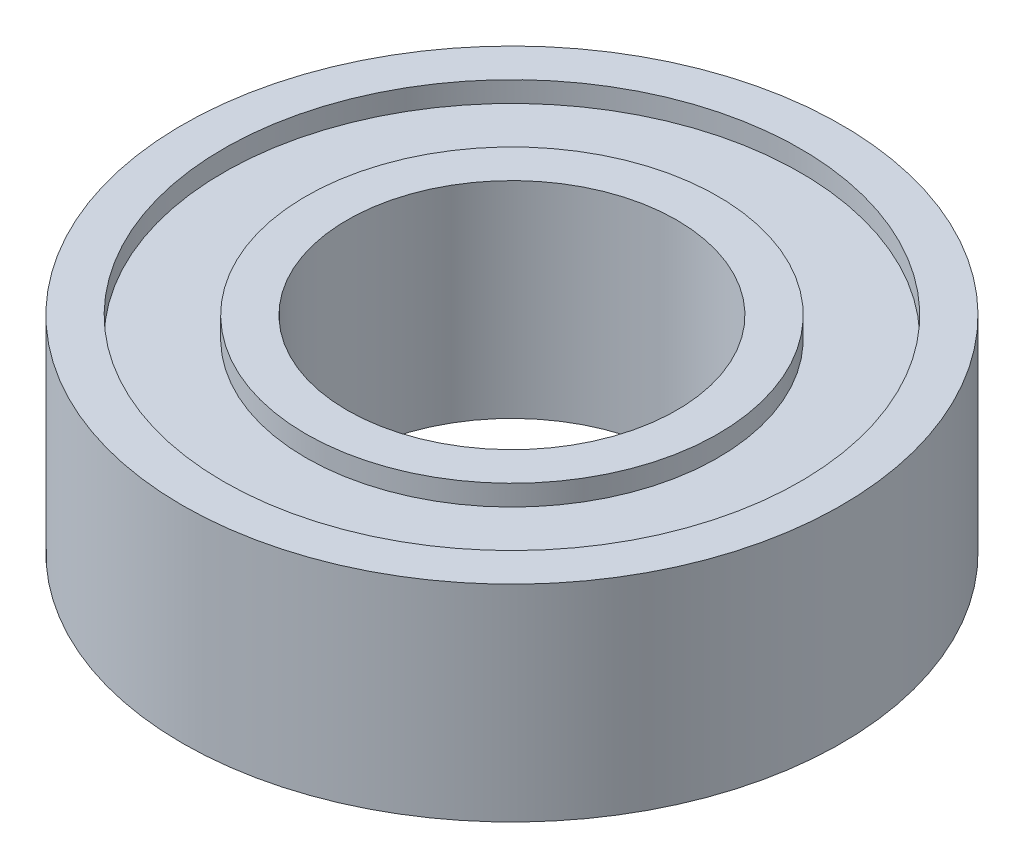
from build123d import *

# Parameters (mm, degrees)
SKETCH2_R             = 8
SKETCH2_R_2           = 7
BOSS_EXTRUDE1_DEPTH   = 5
SKETCH2_R_3           = 5
SKETCH2_R_4           = 4
BOSS_EXTRUDE1_2_DEPTH = 5
BOSS_EXTRUDE2_START   = 0.5
SKETCH2_3_R           = 7
SKETCH2_3_R_2         = 5
BOSS_EXTRUDE2_DEPTH   = 4


with BuildPart() as part:
    # Sketch2 → Boss-Extrude1 (new body)
    with BuildSketch(Plane(origin=(0, 0, 0), x_dir=(1, 0, 0), z_dir=(0, 1, 0))):
        Circle(SKETCH2_R)
        Circle(SKETCH2_R_2, mode=Mode.SUBTRACT)
    extrude(amount=BOSS_EXTRUDE1_DEPTH)



with BuildPart() as body_2:
    # Sketch2 → Boss-Extrude1 2 (new body)
    with BuildSketch(Plane(origin=(0, 0, 0), x_dir=(1, 0, 0), z_dir=(0, 1, 0))):
        Circle(SKETCH2_R_3)
        Circle(SKETCH2_R_4, mode=Mode.SUBTRACT)
    extrude(amount=BOSS_EXTRUDE1_2_DEPTH)


with BuildPart() as part_1:
    add(part.part)

    add(body_2.part)  # Boss-Extrude2 merges body 2
    # Sketch2<3> → Boss-Extrude2 (add)
    with BuildSketch(Plane(origin=(0, 0, 0), x_dir=(1, 0, 0), z_dir=(0, 1, 0)).offset(BOSS_EXTRUDE2_START)):
        Circle(SKETCH2_3_R)
        Circle(SKETCH2_3_R_2, mode=Mode.SUBTRACT)
    extrude(amount=BOSS_EXTRUDE2_DEPTH)


solid = part_1.part
